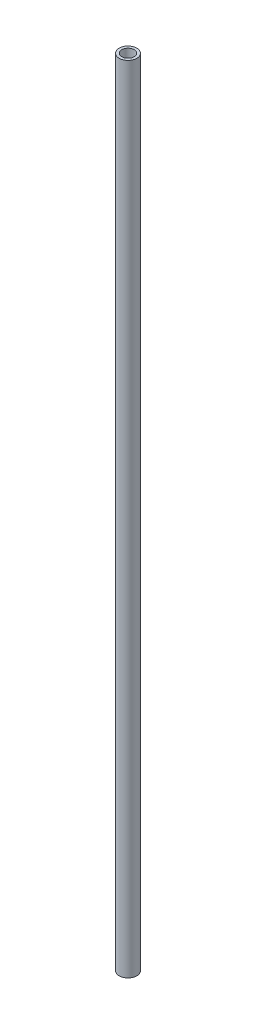
from build123d import *

# Parameters (mm, degrees)
SKETCH1_R           = 5
SKETCH1_R_2         = 3.5
BOSS_EXTRUDE1_DEPTH = 450


with BuildPart() as part:
    # Sketch1 → Boss-Extrude1 (new body)
    with BuildSketch(Plane(origin=(0, 0, 0), x_dir=(1, 0, 0), z_dir=(0, 1, 0))):
        with Locations(Location((0, 0, 0), (0, 0, 270))):
            Circle(SKETCH1_R)
        with Locations(Location((0, 0, 0), (0, 0, 270))):
            Circle(SKETCH1_R_2, mode=Mode.SUBTRACT)
    extrude(amount=BOSS_EXTRUDE1_DEPTH)


solid = part.part
